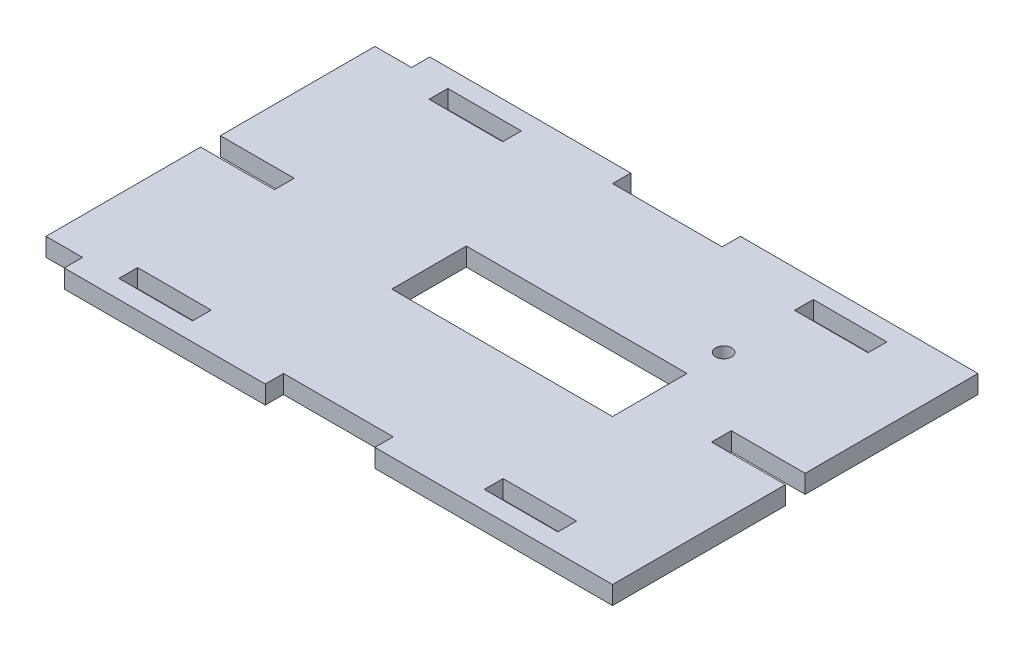
from build123d import *

# Parameters (mm, degrees)
SKETCH1_R           = 2.778125
SKETCH1_W           = 76.708
SKETCH1_H           = 25.908
BOSS_EXTRUDE1_DEPTH = 6.35
SKETCH4_W           = 12.7
SKETCH4_H           = 6.35
SKETCH4_W_2         = 25.5524
SKETCH4_H_2         = 6.5024
SKETCH4_W_3         = 38.1
CUT_EXTRUDE1_DEPTH  = 240.70724332


with BuildPart() as part:
    # Sketch1 → Boss-Extrude1 (new body)
    with BuildSketch(Plane(origin=(0, 0, 0), x_dir=(1, 0, 0), z_dir=(0, 1, 0))):
        Polygon((0, 0), (203.2, 0), (203.2, 60.071), (177.546, 60.071), (177.546, 66.929), (203.2, 66.929), (203.2, 127), (0, 127), (0, 66.929), (25.654, 66.929), (25.654, 60.071), (0, 60.071), align=None)
        with Locations(Location((152.654, 89.154, 0), (0, 0, 270))):
            Circle(SKETCH1_R, mode=Mode.SUBTRACT)
        with Locations((114.3, 63.5)):
            Rectangle(SKETCH1_W, SKETCH1_H, mode=Mode.SUBTRACT)
    extrude(amount=BOSS_EXTRUDE1_DEPTH)

    # Sketch4 → Cut-Extrude1 (cut, through all)
    with BuildSketch(Plane(origin=(0, 6.35, 0), x_dir=(1, 0, 0), z_dir=(0, 1, 0))):
        with Locations((6.35, 123.825)):
            Rectangle(SKETCH4_W, SKETCH4_H)
        with Locations((38.1, 117.3988)):
            Rectangle(SKETCH4_W_2, SKETCH4_H_2)
        with Locations((101.6, 123.825)):
            Rectangle(SKETCH4_W_3, SKETCH4_H)
        with Locations((165.1, 117.3988)):
            Rectangle(SKETCH4_W_2, SKETCH4_H_2)
        with Locations((165.1, 9.6012)):
            Rectangle(SKETCH4_W_2, SKETCH4_H_2)
        with Locations((101.6, 3.175)):
            Rectangle(SKETCH4_W_3, SKETCH4_H)
        with Locations((38.1, 9.6012)):
            Rectangle(SKETCH4_W_2, SKETCH4_H_2)
        with Locations((6.35, 3.175)):
            Rectangle(SKETCH4_W, SKETCH4_H)
    extrude(amount=-CUT_EXTRUDE1_DEPTH, mode=Mode.SUBTRACT)


solid = part.part
